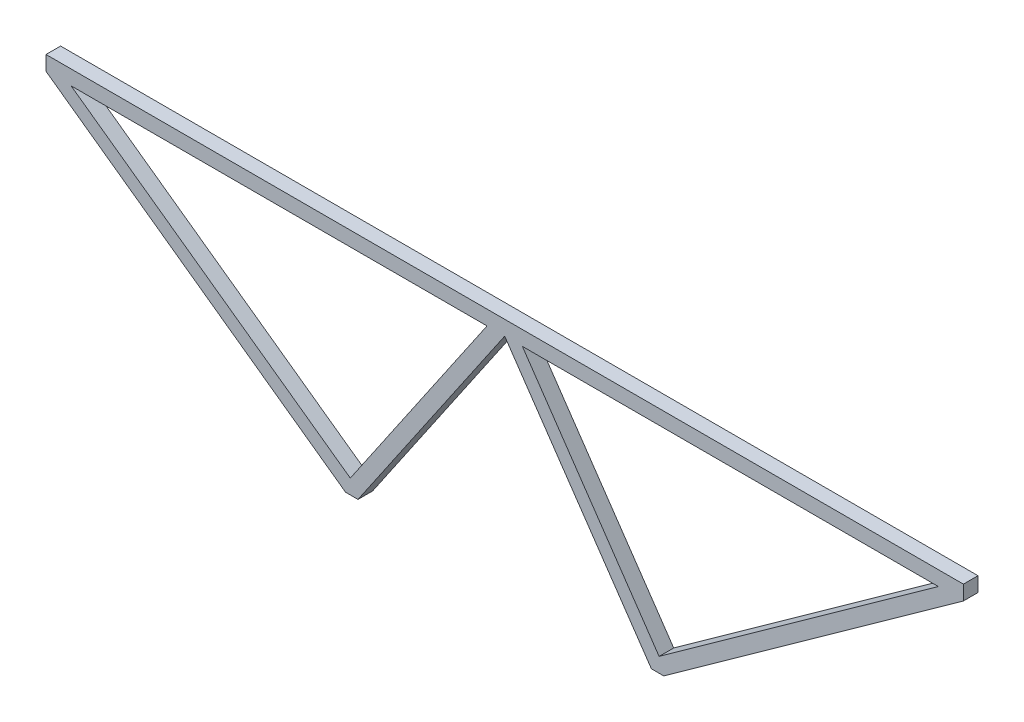
from build123d import *

# Parameters (mm, degrees)
BOSS_EXTRUDE2_DEPTH = 19.1


with BuildPart() as part:
    # Sketch3 → Boss-Extrude2 (new body)
    with BuildSketch(Plane.XY):
        Polygon((391.889090758, -300), (408.110909242, -300), (600, -19.1), (791.889090758, -300), (808.110909242, -300), (1200, -19.1), (1200, 0), (0, 0), (0, -19.1), align=None)
        Polygon((32.785074333, -19.1), (576.868833396, -19.1), (398.027381063, -280.9), align=None, mode=Mode.SUBTRACT)
        Polygon((801.972618937, -280.9), (1167.214925667, -19.1), (623.131166604, -19.1), align=None, mode=Mode.SUBTRACT)
    extrude(amount=BOSS_EXTRUDE2_DEPTH)


solid = part.part
